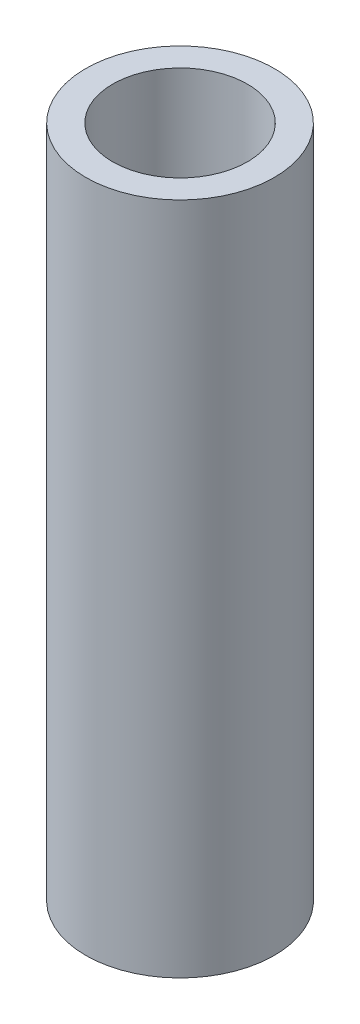
from build123d import *

# Parameters (mm, degrees)
ESBO_O1_R                = 3.5
ESBO_O1_R_2              = 2.5
RESSALTO_EXTRUS_O1_DEPTH = 25


with BuildPart() as part:
    # Esboço1 → Ressalto-extrusão1 (new body)
    with BuildSketch(Plane(origin=(0, 0, 0), x_dir=(1, 0, 0), z_dir=(0, 1, 0))):
        with Locations(Location((0, 0, 0), (0, 0, 270))):
            Circle(ESBO_O1_R)
        with Locations(Location((0, 0, 0), (0, 0, 270))):
            Circle(ESBO_O1_R_2, mode=Mode.SUBTRACT)
    extrude(amount=RESSALTO_EXTRUS_O1_DEPTH)


solid = part.part
